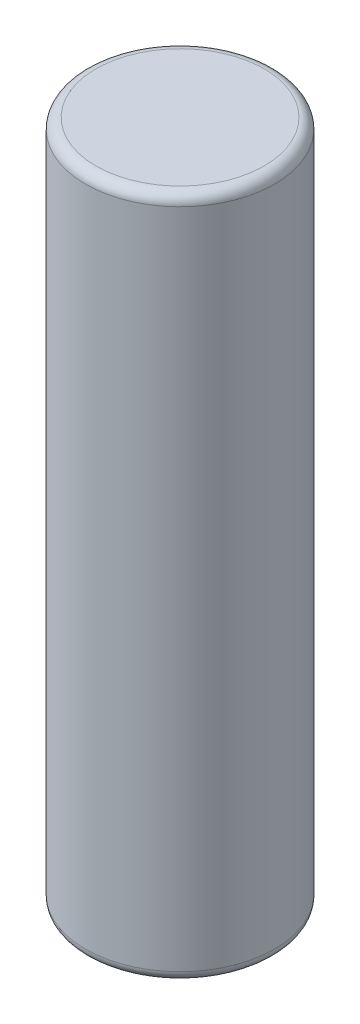
from build123d import *

# Parameters (mm, degrees)
SKETCH1_R           = 9
BOSS_EXTRUDE1_DEPTH = 65
FILLET1_R           = 1


with BuildPart() as part:
    # Sketch1 → Boss-Extrude1 (new body)
    with BuildSketch(Plane(origin=(0, 0, 0), x_dir=(1, 0, 0), z_dir=(0, 1, 0))):
        with Locations(Location((0, 0, 0), (0, 0, 270))):
            Circle(SKETCH1_R)
    extrude(amount=BOSS_EXTRUDE1_DEPTH)

    # Fillet1
    fillet1_edges = [part.edges().sort_by_distance(p)[0] for p in [
        (0, 0, -9),
        (0, 65, -9),
    ]]
    fillet(fillet1_edges, radius=FILLET1_R)


solid = part.part
